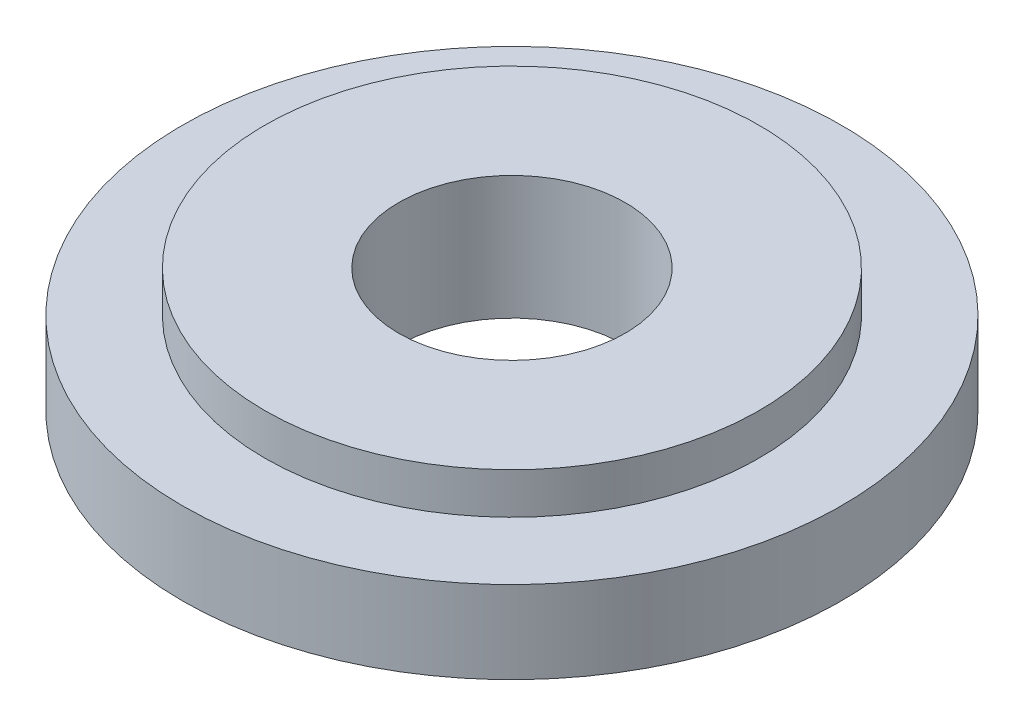
from build123d import *

# Parameters (mm, degrees)
SKETCH1_R           = 8
SKETCH1_R_2         = 2.75
BOSS_EXTRUDE1_DEPTH = 2
SKETCH3_R           = 6
SKETCH3_R_2         = 2.75
BOSS_EXTRUDE2_DEPTH = 1


with BuildPart() as part:
    # Sketch1 → Boss-Extrude1 (new body)
    with BuildSketch(Plane(origin=(0, 0, 0), x_dir=(1, 0, 0), z_dir=(0, 1, 0))):
        with Locations(Location((0, 0, 0), (0, 0, 270))):
            Circle(SKETCH1_R)
        with Locations(Location((0, 0, 0), (0, 0, 270))):
            Circle(SKETCH1_R_2, mode=Mode.SUBTRACT)
    extrude(amount=BOSS_EXTRUDE1_DEPTH)

    # Sketch3 → Boss-Extrude2 (add, symmetric)
    with BuildSketch(Plane(origin=(0, 2, 0), x_dir=(1, 0, 0), z_dir=(0, 1, 0))):
        with Locations(Location((0, 0, 0), (0, 0, 270))):
            Circle(SKETCH3_R)
        with Locations(Location((0, 0, 0), (0, 0, 270))):
            Circle(SKETCH3_R_2, mode=Mode.SUBTRACT)
    extrude(amount=BOSS_EXTRUDE2_DEPTH, both=True)


solid = part.part
